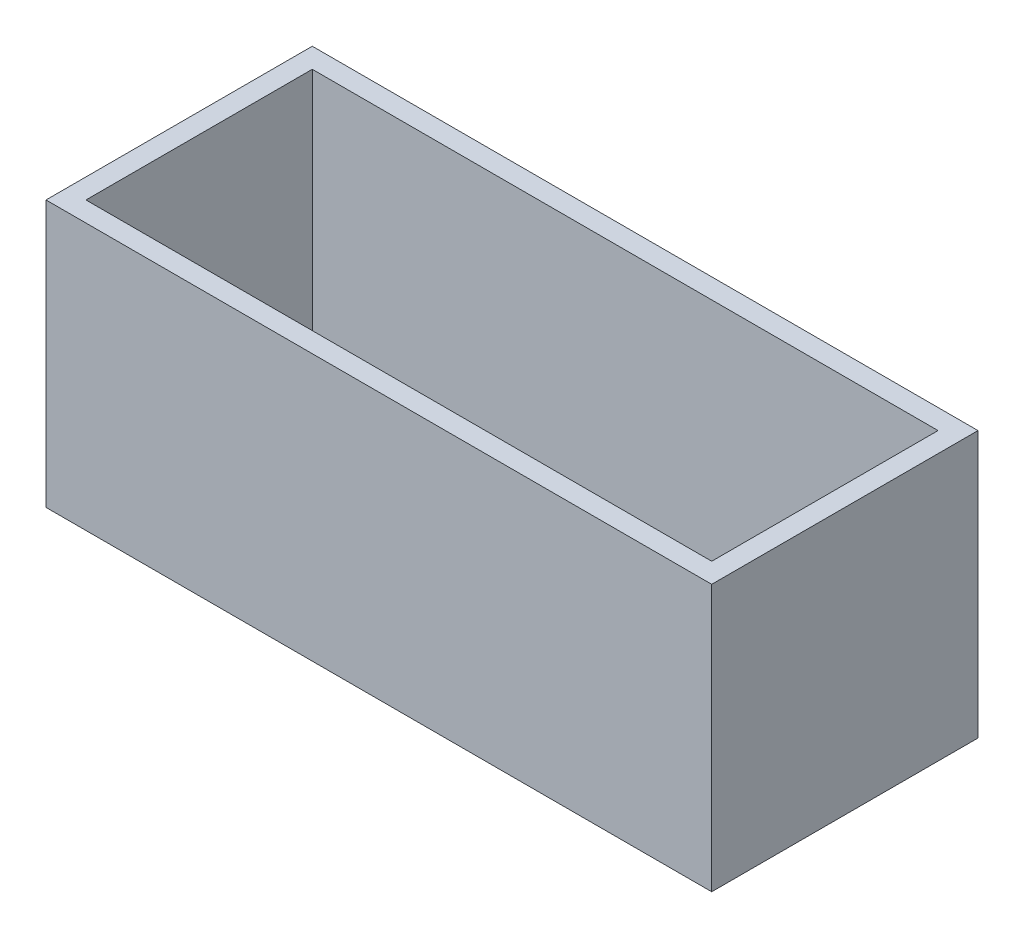
from build123d import *

# Parameters (mm, degrees)
SKETCH2_W           = 100
SKETCH2_H           = 40
BOSS_EXTRUDE1_DEPTH = 40
SKETCH3_W           = 94
SKETCH3_H           = 34
CUT_EXTRUDE1_DEPTH  = 37


with BuildPart() as part:
    # Sketch2 → Boss-Extrude1 (new body)
    with BuildSketch(Plane(origin=(0, 0, 0), x_dir=(1, 0, 0), z_dir=(0, 1, 0))):
        Rectangle(SKETCH2_W, SKETCH2_H)
    extrude(amount=BOSS_EXTRUDE1_DEPTH)

    # Sketch3 → Cut-Extrude1 (cut)
    with BuildSketch(Plane(origin=(0, 40, 0), x_dir=(1, 0, 0), z_dir=(0, 1, 0))):
        Rectangle(SKETCH3_W, SKETCH3_H)
    extrude(amount=-CUT_EXTRUDE1_DEPTH, mode=Mode.SUBTRACT)


solid = part.part
